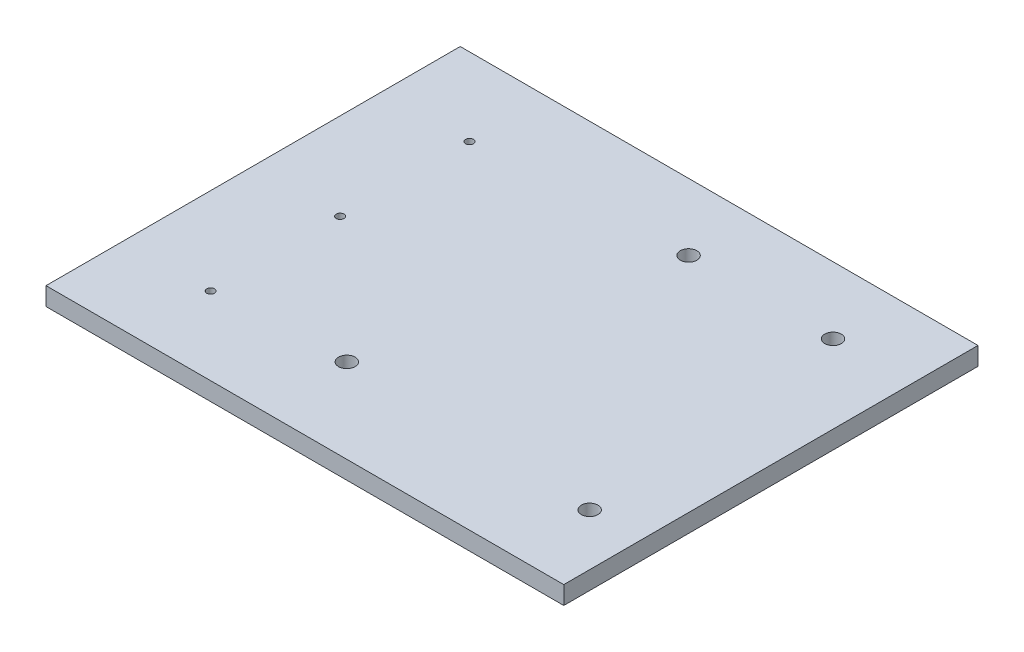
from build123d import *

# Parameters (mm, degrees)
SKETCH1_W           = 100
SKETCH1_H           = 80
BOSS_EXTRUDE1_DEPTH = 3.5
SKETCH2_R           = 1.6
SKETCH2_R_2         = 0.75
CUT_EXTRUDE1_DEPTH  = 65.126827459


with BuildPart() as part:
    # Sketch1 → Boss-Extrude1 (new body)
    with BuildSketch(Plane(origin=(0, 0, 0), x_dir=(1, 0, 0), z_dir=(0, 1, 0))):
        Rectangle(SKETCH1_W, SKETCH1_H)
    extrude(amount=BOSS_EXTRUDE1_DEPTH)

    # Sketch2 → Cut-Extrude1 (cut, through all)
    with BuildSketch(Plane(origin=(0, 3.5, 0), x_dir=(1, 0, 0), z_dir=(0, 1, 0))):
        with Locations(Location((40, -25, 0), (0, 0, 270))):
            Circle(SKETCH2_R)
        with Locations(Location((-8.2, -23.7, 0), (0, 0, 270))):
            Circle(SKETCH2_R)
        with Locations(Location((7, 27.1, 0), (0, 0, 270))):
            Circle(SKETCH2_R)
        with Locations(Location((34.9, 27.1, 0), (0, 0, 270))):
            Circle(SKETCH2_R)
        with Locations(Location((-33.2, -25, 0), (0, 0, 270))):
            Circle(SKETCH2_R_2)
        with Locations(Location((-33.2, 25, 0), (0, 0, 90))):
            Circle(SKETCH2_R_2)
        with Locations(Location((-33.2, 0, 0), (0, 0, 270))):
            Circle(SKETCH2_R_2)
    extrude(amount=-CUT_EXTRUDE1_DEPTH, mode=Mode.SUBTRACT)


solid = part.part
